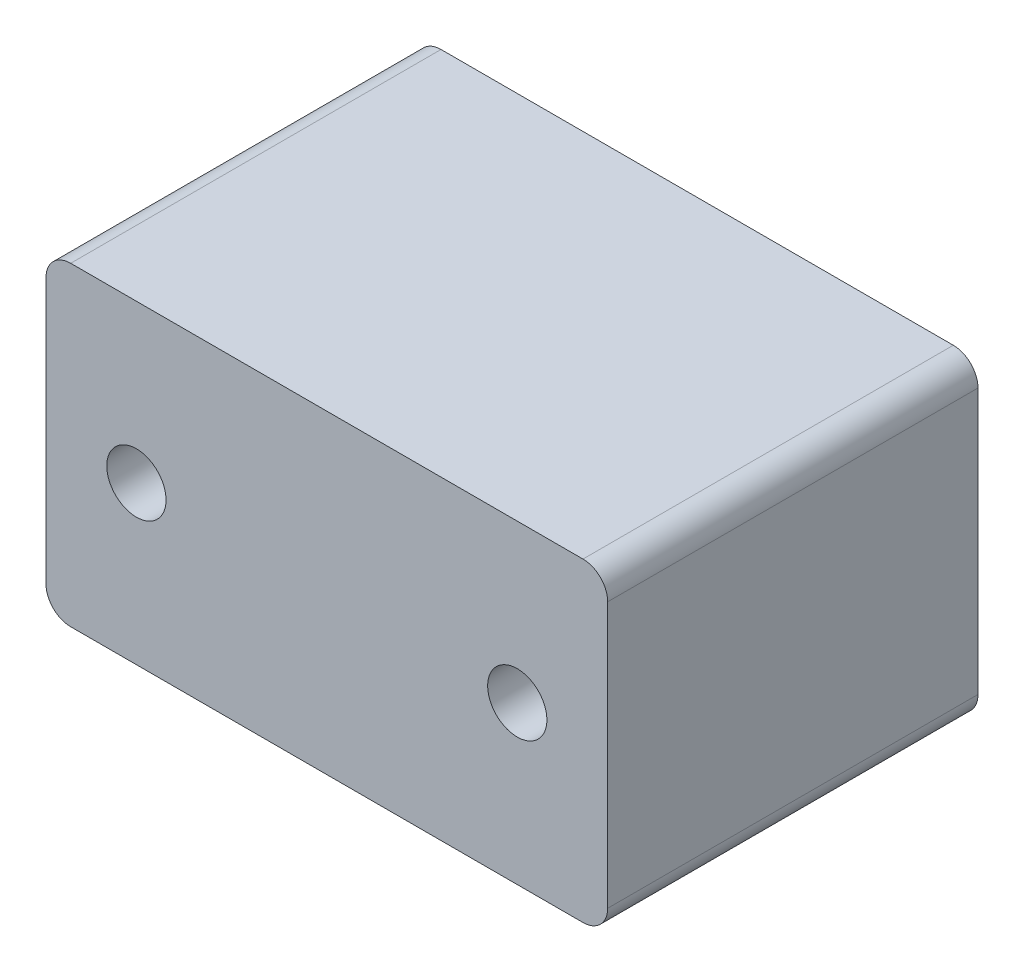
from build123d import *

# Parameters (mm, degrees)
SKETCH1_W           = 45.5
SKETCH1_H           = 25.5
SKETCH1_R           = 2.4
BOSS_EXTRUDE1_DEPTH = 15
FILLET1_R           = 2


with BuildPart() as part:
    # Sketch1 → Boss-Extrude1 (new, symmetric)
    with BuildSketch(Plane.XY):
        Rectangle(SKETCH1_W, SKETCH1_H)
        with Locations((-15.426369863, 0)):
            Circle(SKETCH1_R, mode=Mode.SUBTRACT)
        with Locations((15.426369863, 0)):
            Circle(SKETCH1_R, mode=Mode.SUBTRACT)
    extrude(amount=BOSS_EXTRUDE1_DEPTH, both=True)

    # Fillet1
    fillet1_edges = [part.edges().sort_by_distance(p)[0] for p in [
        (-22.75, -12.75, 0),
        (22.75, -12.75, 0),
        (-22.75, 12.75, 0),
        (22.75, 12.75, 0),
    ]]
    fillet(fillet1_edges, radius=FILLET1_R)


solid = part.part
